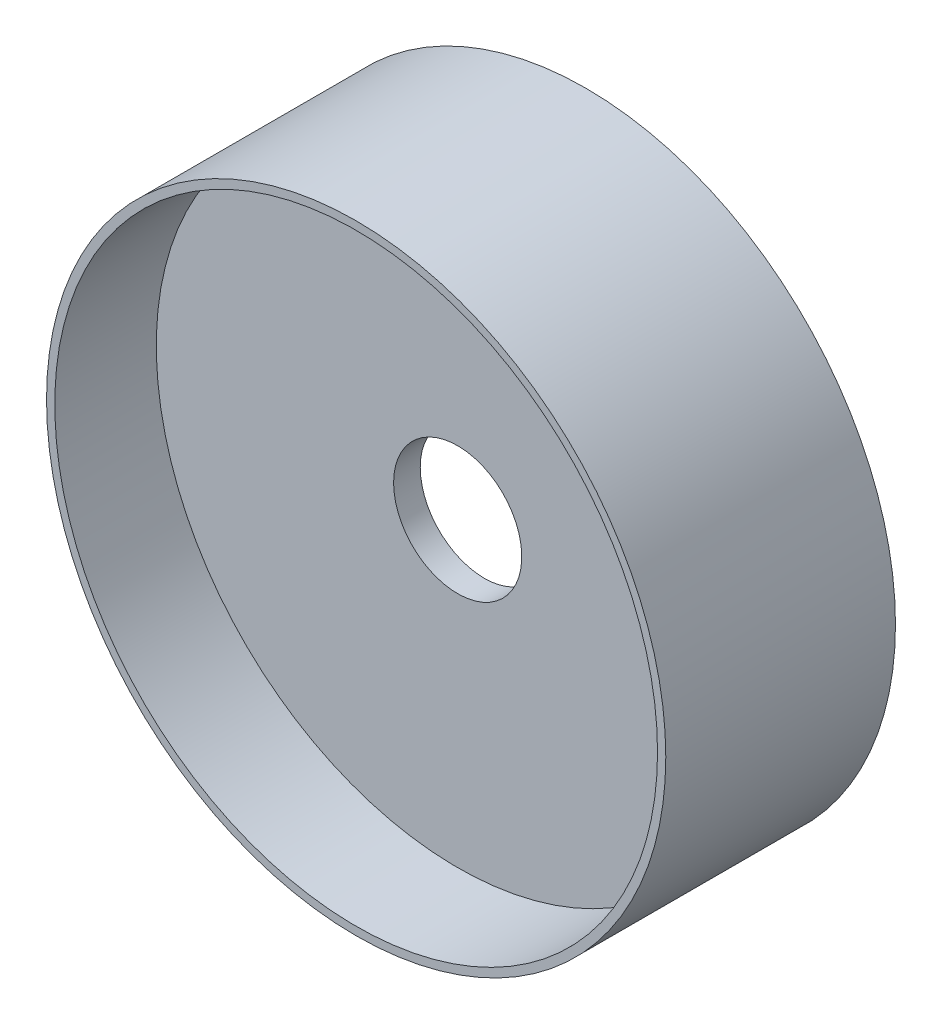
from build123d import *

# Parameters (mm, degrees)
SKETCH1_R           = 61.976
SKETCH1_R_2         = 12.827
BOSS_EXTRUDE1_DEPTH = 45.974
SKETCH2_R           = 60.325
CUT_EXTRUDE1_DEPTH  = 20.32


with BuildPart() as part:
    # Sketch1 → Boss-Extrude1 (new body)
    with BuildSketch(Plane.XY):
        Circle(SKETCH1_R)
        Circle(SKETCH1_R_2, mode=Mode.SUBTRACT)
    extrude(amount=BOSS_EXTRUDE1_DEPTH)

    # Sketch2 → Cut-Extrude1 (cut)
    with BuildSketch(Plane.XY):
        Circle(SKETCH2_R)
    cut_extrude1 = extrude(amount=CUT_EXTRUDE1_DEPTH, mode=Mode.SUBTRACT)

    # Mirror1: Cut-Extrude1 across plane
    add(cut_extrude1.mirror(Plane.XY.offset(22.987)), mode=Mode.SUBTRACT)


solid = part.part
